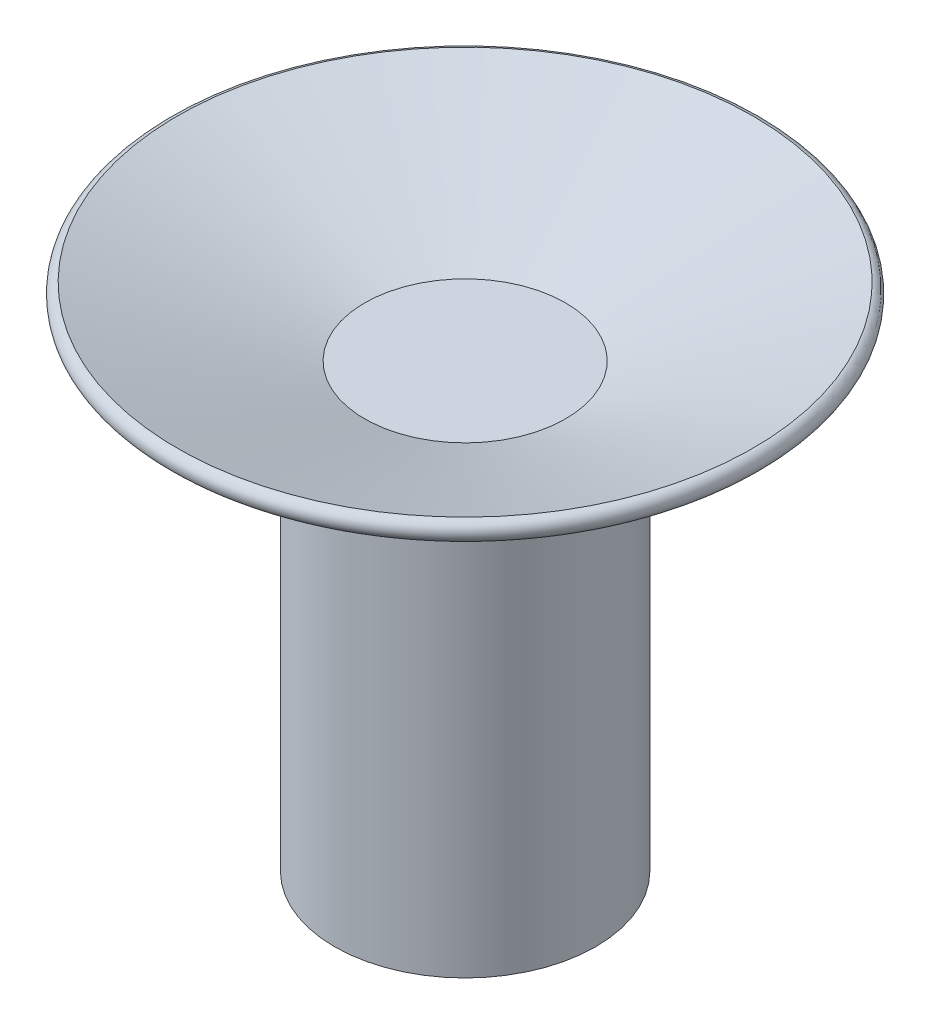
from build123d import *

# Parameters (mm, degrees)
BOSS_EXTRU_1_DEPTH  = 1
SKETCH1_R           = 6.5
BOSS_EXTRUDE1_DEPTH = 20


with BuildPart() as part:
    # Esquisse1 → Révolution1 (revolve)
    with BuildSketch(Plane.XY, mode=Mode.PRIVATE) as r_volution1_sk:
        with BuildLine():
            Line((0, 0), (5, 0))
            Line((5, 0), (14.396926208, 3.420201433))
            ThreePointArc((14.396926208, 3.420201433), (14.728803197, 3.934870166), (14.322587886, 4.393144497))
            Line((14.322587886, 4.393144497), (5, 1))
            Line((5, 1), (0, 1))
            Line((0, 1), (0, 0))
        make_face()
    revolve(r_volution1_sk.sketch.rotate(Axis((0, 0, 0), (0, 1, 0)), 90), axis=Axis((0, 0, 0), (0, 1, 0)))

    # Esquisse2 → Boss.-Extru.1 (add)
    with BuildSketch(Plane.XZ):
        Polygon((2.792425312, -4.14757289), (4.988116143, 0.344524813), (2.195690831, 4.492097703), (-2.792425312, 4.14757289), (-4.988116143, -0.344524813), (-2.195690831, -4.492097703), align=None)
    extrude(amount=BOSS_EXTRU_1_DEPTH)

    # Sketch1 → Boss-Extrude1 (add)
    with BuildSketch(Plane.XZ.offset(1)):
        with Locations(Location((0, 0, 0), (0, 0, 270))):
            Circle(SKETCH1_R)
    extrude(amount=BOSS_EXTRUDE1_DEPTH)


solid = part.part
